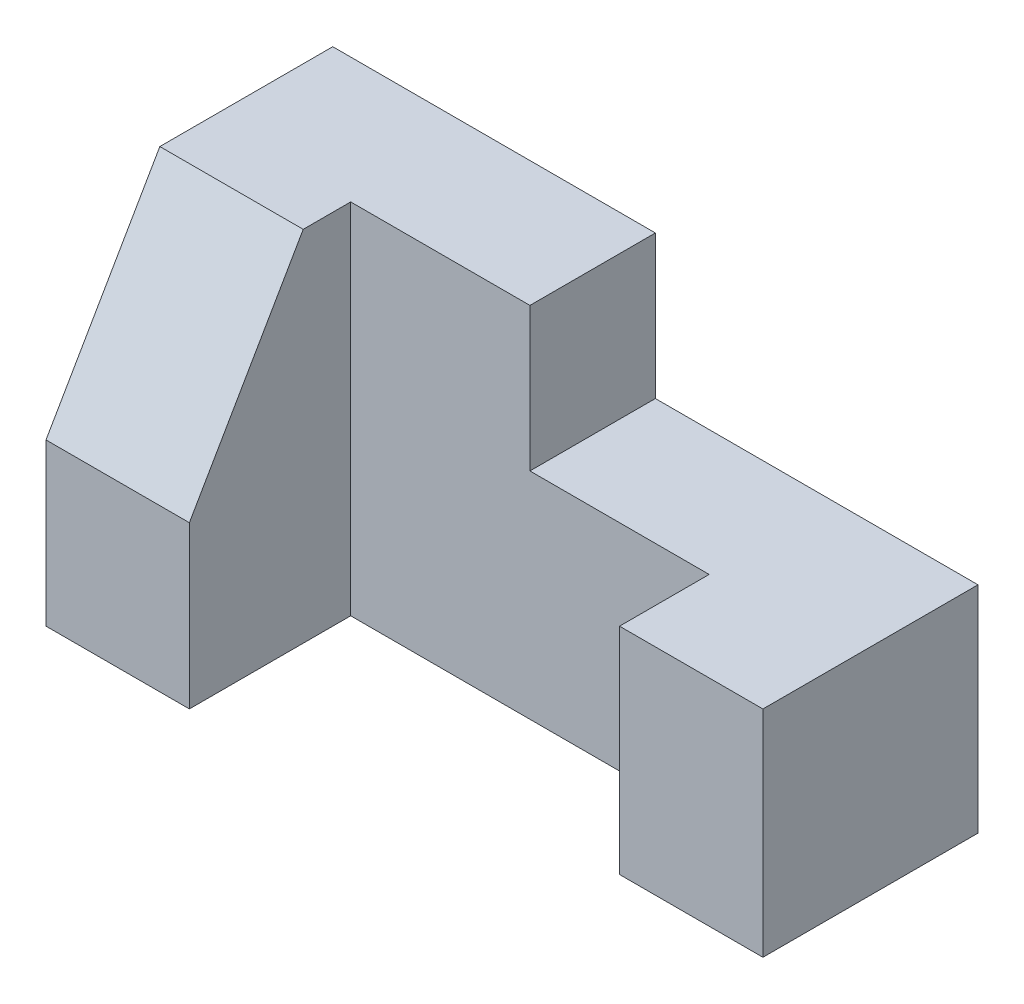
from build123d import *

# Parameters (mm, degrees)
BOSS_EXTRUDE1_DEPTH = 22.225
SKETCH1_3_W         = 25.4
SKETCH1_3_H         = 38.1
BOSS_EXTRUDE2_DEPTH = 38.1
SKETCH1_4_W         = 25.4
SKETCH1_4_H         = 63.5
BOSS_EXTRUDE3_DEPTH = 50.8
CUT_EXTRUDE1_DEPTH  = 25.4


with BuildPart() as part:
    # Sketch1 → Boss-Extrude1 (new body)
    with BuildSketch(Plane.XY):
        Polygon((25.4, 28.575), (25.4, 0), (88.9, 0), (88.9, 38.1), (57.15, 38.1), (57.15, 63.5), (25.4, 63.5), align=None)
    extrude(amount=BOSS_EXTRUDE1_DEPTH)

    # Sketch1<3> → Boss-Extrude2 (add)
    with BuildSketch(Plane.XY):
        with Locations((101.6, 19.05)):
            Rectangle(SKETCH1_3_W, SKETCH1_3_H)
    extrude(amount=BOSS_EXTRUDE2_DEPTH)

    # Sketch1<4> → Boss-Extrude3 (add)
    with BuildSketch(Plane.XY):
        with Locations((12.7, 31.75)):
            Rectangle(SKETCH1_4_W, SKETCH1_4_H)
    extrude(amount=BOSS_EXTRUDE3_DEPTH)

    # Sketch2 → Cut-Extrude1 (cut)
    with BuildSketch(Plane.ZY):
        Polygon((50.8, 28.575), (30.636041849, 63.5), (50.8, 63.5), align=None)
    extrude(amount=-CUT_EXTRUDE1_DEPTH, mode=Mode.SUBTRACT)


solid = part.part
